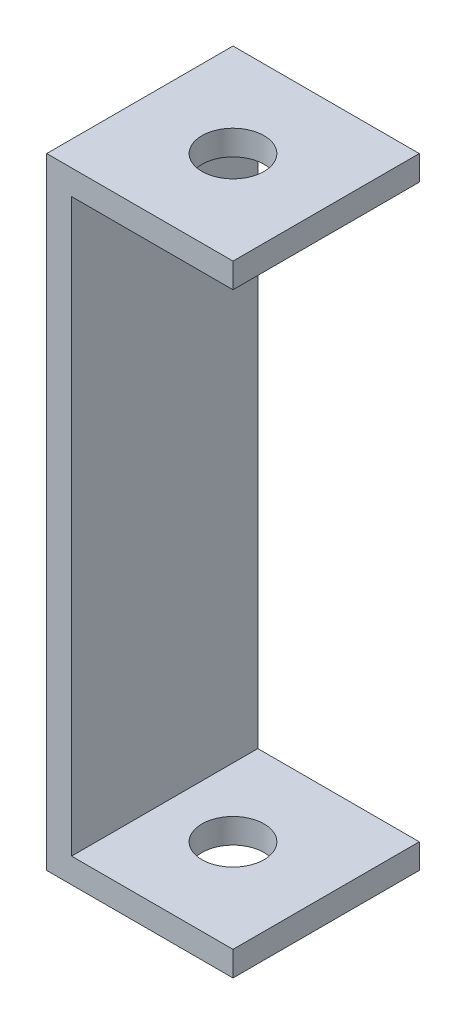
from build123d import *

# Parameters (mm, degrees)
SALIENTE_EXTRUIR1_DEPTH = 15
CROQUIS2_R              = 2.5
CORTAR_EXTRUIR1_DEPTH   = 55.313902456


with BuildPart() as part:
    # Croquis1 → Saliente-Extruir1 (new body)
    with BuildSketch(Plane.XY):
        Polygon((15, 0), (0, 0), (0, 50), (15, 50), (15, 48), (2, 48), (2, 2), (15, 2), align=None)
    extrude(amount=SALIENTE_EXTRUIR1_DEPTH)

    # Croquis2 → Cortar-Extruir1 (cut, through all)
    with BuildSketch(Plane(origin=(0, 50, 0), x_dir=(1, 0, 0), z_dir=(0, 1, 0))):
        with Locations(Location((7.5, -7.5, 0), (0, 0, 270))):
            Circle(CROQUIS2_R)
    extrude(amount=-CORTAR_EXTRUIR1_DEPTH, mode=Mode.SUBTRACT)


solid = part.part
